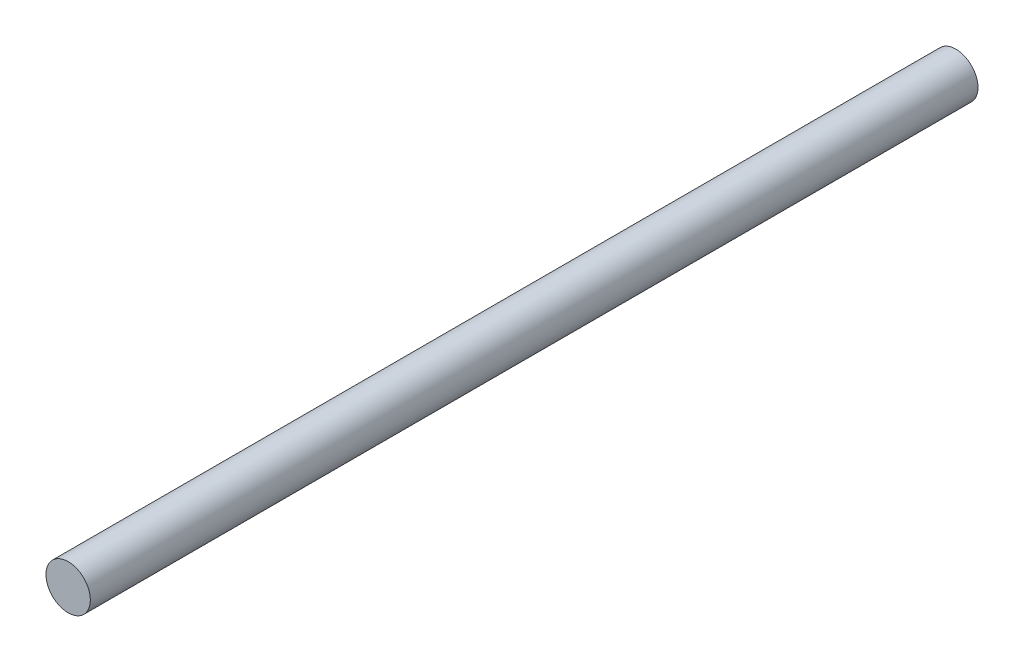
from build123d import *

# Parameters (mm, degrees)
CROQUIS1_R              = 4.75
SALIENTE_EXTRUIR1_DEPTH = 190


with BuildPart() as part:
    # Croquis1 → Saliente-Extruir1 (new body)
    with BuildSketch(Plane.XY):
        Circle(CROQUIS1_R)
    extrude(amount=SALIENTE_EXTRUIR1_DEPTH)


solid = part.part
